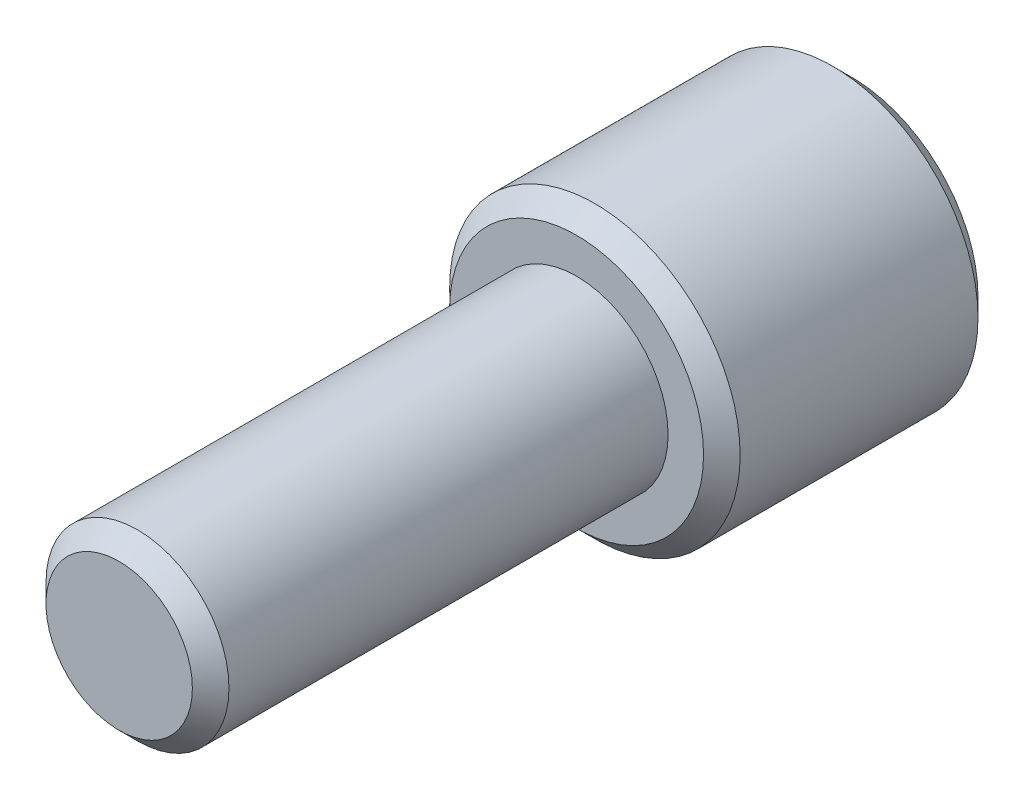
from build123d import *

# Parameters (mm, degrees)
CROQUIS1_R              = 6.35
SALIENTE_EXTRUIR1_DEPTH = 12
CROQUIS2_R              = 4
SALIENTE_EXTRUIR2_DEPTH = 20
CROQUIS3_R              = 2.5
CORTAR_EXTRUIR1_DEPTH   = 10
CROQUIS4_R              = 2
CORTAR_EXTRUIR2_DEPTH   = 34.236200144
CROQUIS5_R              = 2
CORTAR_EXTRUIR3_DEPTH   = 34.236200182
CHAFL_N1_SIZE           = 0.8


with BuildPart() as part:
    # Croquis1 → Saliente-Extruir1 (new body)
    with BuildSketch(Plane.XY):
        Circle(CROQUIS1_R)
    extrude(amount=SALIENTE_EXTRUIR1_DEPTH)

    # Croquis2 → Saliente-Extruir2 (add)
    with BuildSketch(Plane.XY.offset(12)):
        Circle(CROQUIS2_R)
    extrude(amount=SALIENTE_EXTRUIR2_DEPTH)

    # Croquis3 → Cortar-Extruir1 (cut)
    with BuildSketch(Plane(origin=(0, 0, 0), x_dir=(-1, 0, 0), z_dir=(0, 0, -1))):
        Circle(CROQUIS3_R)
    extrude(amount=-CORTAR_EXTRUIR1_DEPTH, mode=Mode.SUBTRACT)

    # Croquis4 → Cortar-Extruir2 (cut, through all)
    with BuildSketch(Plane(origin=(0, 0, 0), x_dir=(0, 0, -1), z_dir=(1, 0, 0))):
        with Locations((-6, 0)):
            Circle(CROQUIS4_R)
    extrude(amount=-CORTAR_EXTRUIR2_DEPTH, mode=Mode.SUBTRACT)

    # Croquis5 → Cortar-Extruir3 (cut, through all)
    with BuildSketch(Plane(origin=(0, 0, 0), x_dir=(1, 0, 0), z_dir=(0, 1, 0))):
        with Locations(Location((0, -6, 0), (0, 0, 270))):
            Circle(CROQUIS5_R)
    extrude(amount=-CORTAR_EXTRUIR3_DEPTH, mode=Mode.SUBTRACT)

    # Chaflán1
    chafl_n1_edges = [part.edges().sort_by_distance(p)[0] for p in [
        (-6.35, 0, 0),
        (-6.35, 0, 12),
        (-4, 0, 32),
    ]]
    chamfer(chafl_n1_edges, length=CHAFL_N1_SIZE)


solid = part.part
